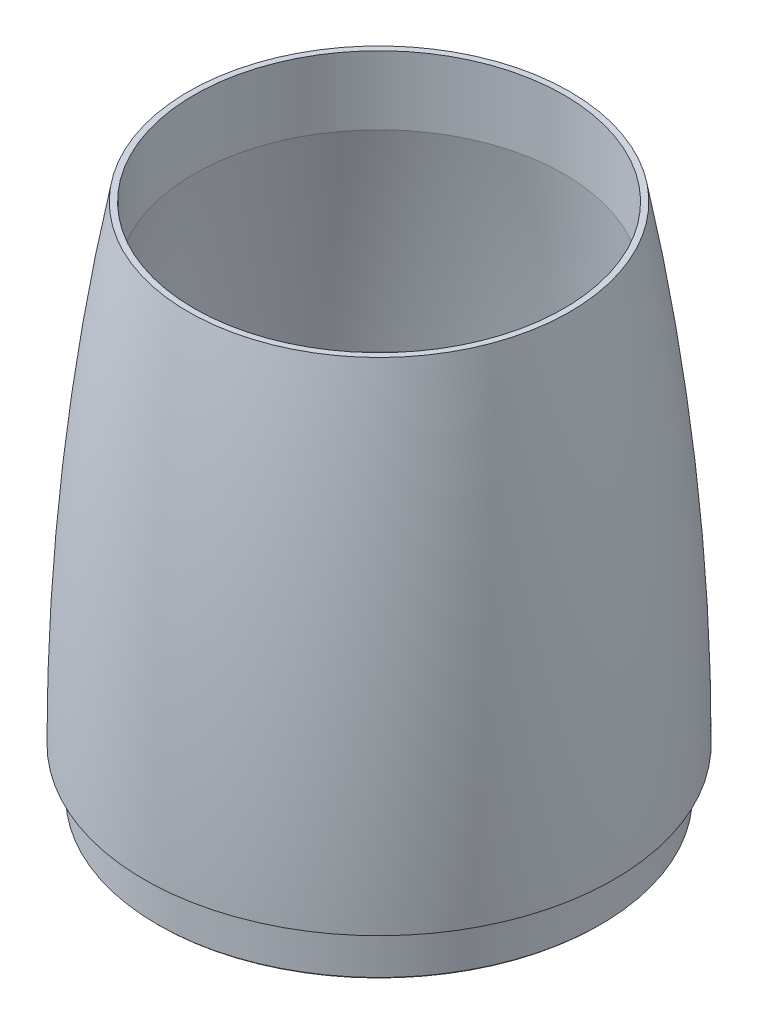
from build123d import *

# Parameters (mm, degrees)
CHAMFER1_SIZE = 0.25


with BuildPart() as part:
    # Sketch1 → Revolve1 (revolve)
    with BuildSketch(Plane.XY, mode=Mode.PRIVATE) as revolve1_sk:
        with BuildLine():
            Line((-32.5, 80), (-31.5, 80))
            Line((-31.5, 80), (-31.5, 68.347153074))
            ThreePointArc((-31.5, 68.347153074), (-34.000163087, 50.550584229), (-35.75, 32.664647046))
            Line((-35.75, 32.664647046), (-35.75, -8))
            Line((-35.75, -8), (-37.75, -8))
            Line((-37.75, -8), (-37.75, 0))
            Line((-37.75, 0), (-40, 0))
            ThreePointArc((-40, 0), (-38.120898133, 40.1753967), (-32.5, 80))
        make_face()
    revolve(revolve1_sk.sketch.rotate(Axis((0, -1572.02612714, 0), (0, 1, 0)), 270), axis=Axis((0, -1572.02612714, 0), (0, 1, 0)))

    # Chamfer1
    chamfer1_edges = [part.edges().sort_by_distance(p)[0] for p in [
        (0, -8, 35.75),
        (0, -8, 37.75),
    ]]
    chamfer(chamfer1_edges, length=CHAMFER1_SIZE)


solid = part.part
